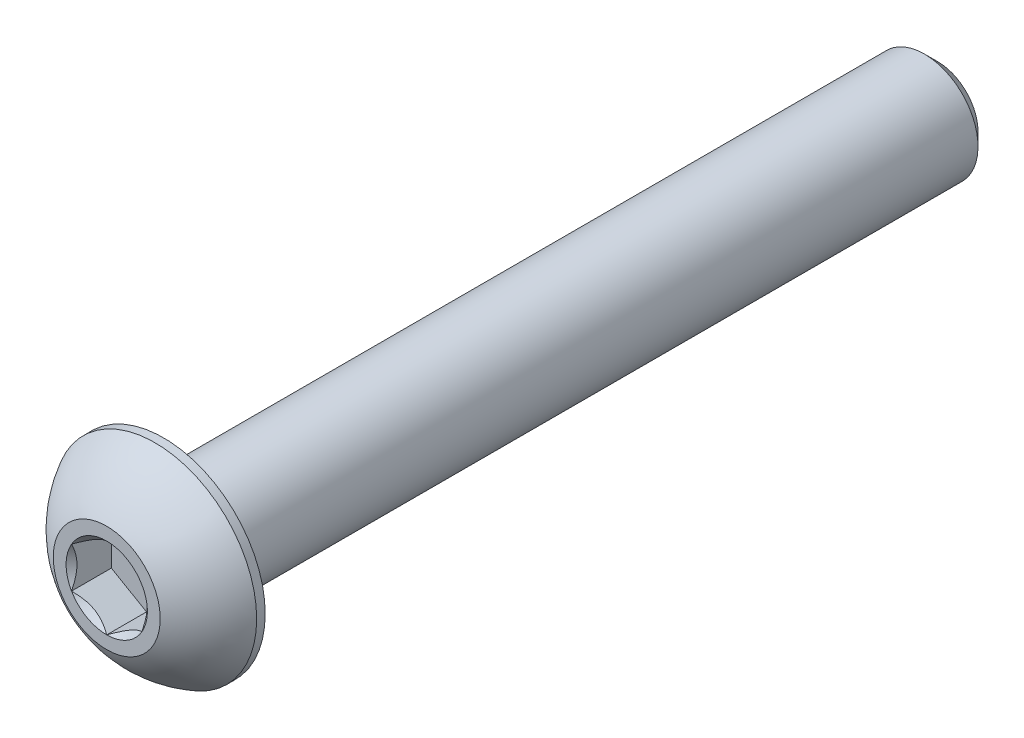
from build123d import *

# Parameters (mm, degrees)
SKETCH1_W          = 34.925
SKETCH1_H          = 2.413
CHAMFER1_SIZE      = 0.5953125
CUT_EXTRUDE2_DEPTH = 1.79578
SKETCH6_R          = 1.833087105
CUT_EXTRUDE3_DEPTH = 1.79578
CUT_EXTRUDE3_TAPER = 45


with BuildPart() as part:
    # Sketch1 → Revolve1 (revolve)
    with BuildSketch(Plane(origin=(0, 0, 0), x_dir=(0, 0, -1), z_dir=(1, 0, 0))):
        with Locations((20.0279, 1.2065)):
            Rectangle(SKETCH1_W, SKETCH1_H)
    revolve(axis=Axis((0, 0, -37.4904), (0, 0, 1)))

    # Chamfer1
    chamfer1_edges = [part.edges().sort_by_distance(p)[0] for p in [
        (0, -2.413, -37.4904),
    ]]
    chamfer(chamfer1_edges, length=CHAMFER1_SIZE)

    # Sketch7 → Revolve2 (revolve)
    with BuildSketch(Plane(origin=(0, 0, 0), x_dir=(0, 0, -1), z_dir=(1, 0, 0))):
        with BuildLine():
            Line((2.18059, 4.5847), (2.5654, 4.5847))
            Line((2.5654, 4.5847), (2.5654, 0))
            Line((2.5654, 0), (0, 0))
            Line((0, 0), (0, 2.413))
            ThreePointArc((0, 2.413), (0.925030326, 3.664791196), (2.18059, 4.5847))
        make_face()
    revolve(axis=Axis((0, 0, 0), (0, 0, -1)))

    # Sketch5 → Cut-Extrude2 (cut)
    with BuildSketch(Plane.XY):
        Polygon((1.5875, -0.916543552), (1.5875, 0.916543552), (0, 1.833087105), (-1.5875, 0.916543552), (-1.5875, -0.916543552), (0, -1.833087105), align=None)
    extrude(amount=-CUT_EXTRUDE2_DEPTH, mode=Mode.SUBTRACT)

    # Sketch6 → Cut-Extrude3 (cut)
    with BuildSketch(Plane.XY):
        Circle(SKETCH6_R)
    extrude(amount=-CUT_EXTRUDE3_DEPTH, taper=CUT_EXTRUDE3_TAPER, mode=Mode.SUBTRACT)


solid = part.part
